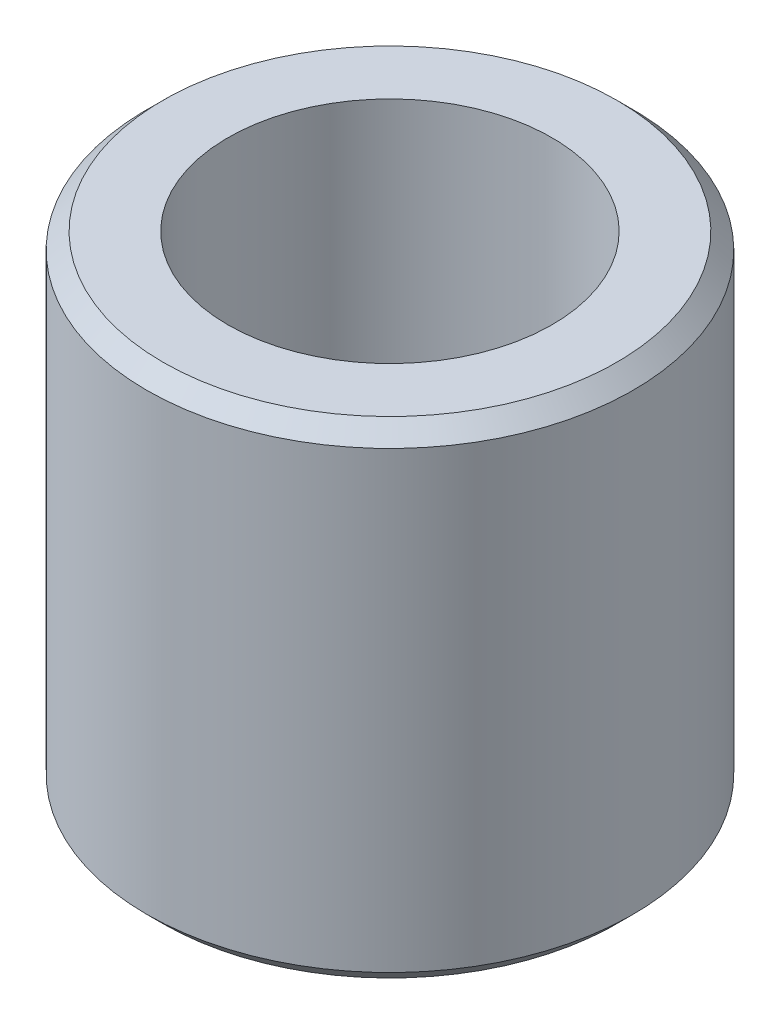
from build123d import *

# Parameters (mm, degrees)
SKETCH1_R           = 15
SKETCH1_R_2         = 10
BOSS_EXTRUDE1_DEPTH = 15
CHAMFER1_SIZE       = 1


with BuildPart() as part:
    # Sketch1 → Boss-Extrude1 (new, symmetric)
    with BuildSketch(Plane(origin=(0, 0, 0), x_dir=(1, 0, 0), z_dir=(0, 1, 0))):
        with Locations(Location((0, 0, 0), (0, 0, 270))):
            Circle(SKETCH1_R)
        with Locations(Location((0, 0, 0), (0, 0, 270))):
            Circle(SKETCH1_R_2, mode=Mode.SUBTRACT)
    extrude(amount=BOSS_EXTRUDE1_DEPTH, both=True)

    # Chamfer1
    chamfer1_edges = [part.edges().sort_by_distance(p)[0] for p in [
        (0, -15, -15),
        (0, 15, -15),
    ]]
    chamfer(chamfer1_edges, length=CHAMFER1_SIZE)


solid = part.part
